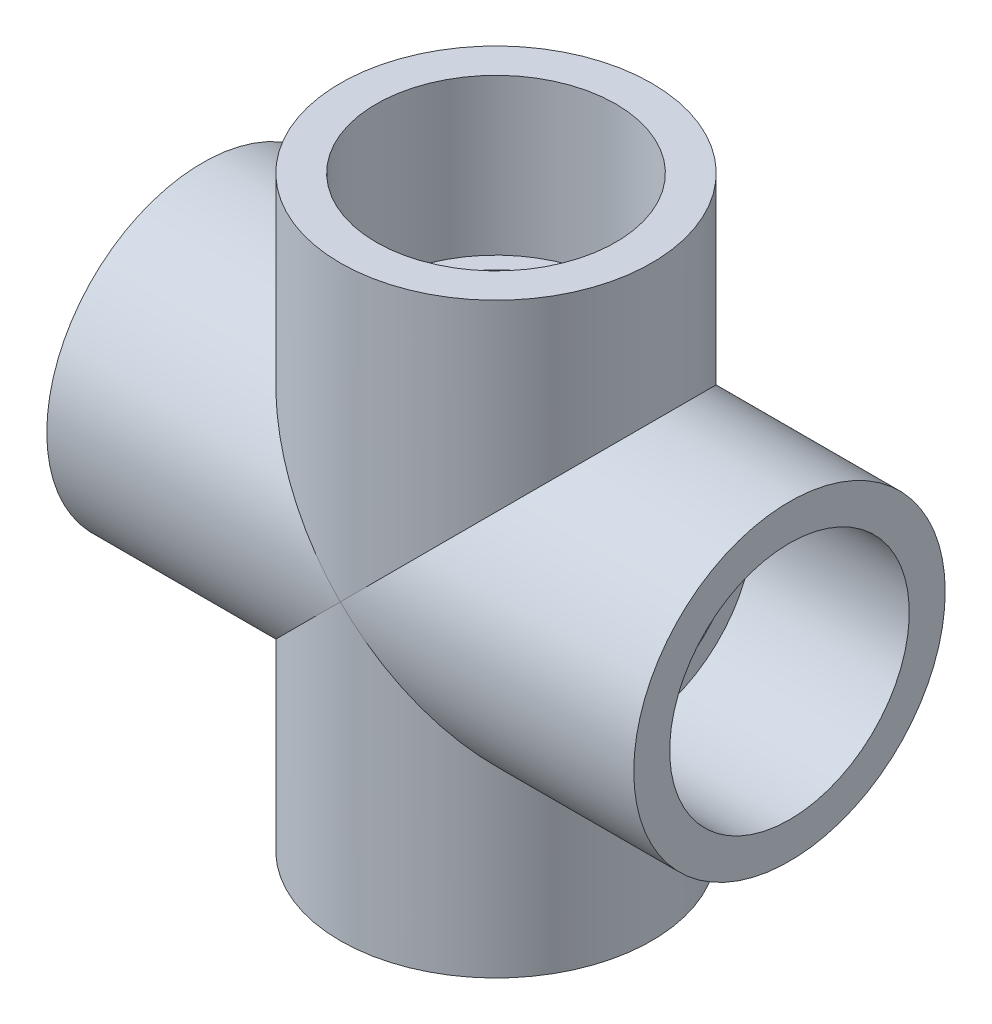
from build123d import *

# Parameters (mm, degrees)
SKETCH1_R           = 26
BOSS_EXTRUDE1_DEPTH = 49
CIRPATTERN1_COUNT   = 2
CIRPATTERN1_ANGLE   = 90
SKETCH2_R           = 20
CUT_EXTRUDE1_DEPTH  = 26
CIRPATTERN2_COUNT   = 4
SKETCH3_R           = 17
CUT_EXTRUDE2_DEPTH  = 91.890043459
CIRPATTERN3_COUNT   = 2
CIRPATTERN3_ANGLE   = 90
SCALE1_SCALE        = 0.2
SCALE2_SCALE        = 0.25


with BuildPart() as part:
    # Sketch1 → Boss-Extrude1 (new, symmetric)
    with BuildSketch(Plane(origin=(0, 0, 0), x_dir=(1, 0, 0), z_dir=(0, 1, 0))):
        Circle(SKETCH1_R)
    boss_extrude1 = extrude(amount=BOSS_EXTRUDE1_DEPTH, both=True)

    # CirPattern1: Boss-Extrude1 ×2 about axis
    cirpattern1_axis = Axis((0, 0, 50), (0, 0, -1))
    for i in range(1, CIRPATTERN1_COUNT):
        add(boss_extrude1.rotate(cirpattern1_axis, i * CIRPATTERN1_ANGLE / (CIRPATTERN1_COUNT - 1)))

    # Sketch2 → Cut-Extrude1 (cut)
    with BuildSketch(Plane(origin=(0, 49, 0), x_dir=(1, 0, 0), z_dir=(0, 1, 0))):
        Circle(SKETCH2_R)
    cut_extrude1 = extrude(amount=-CUT_EXTRUDE1_DEPTH, mode=Mode.SUBTRACT)

    # CirPattern2: Cut-Extrude1 ×4 about axis
    cirpattern2_axis = Axis((0, 0, 50), (0, 0, -1))
    for i in range(1, CIRPATTERN2_COUNT):
        add(cut_extrude1.rotate(cirpattern2_axis, i * 360 / CIRPATTERN2_COUNT), mode=Mode.SUBTRACT)

    # Sketch3 → Cut-Extrude2 (cut, through all)
    with BuildSketch(Plane(origin=(0, 23, 0), x_dir=(1, 0, 0), z_dir=(0, 1, 0))):
        Circle(SKETCH3_R)
    cut_extrude2 = extrude(amount=-CUT_EXTRUDE2_DEPTH, mode=Mode.SUBTRACT)

    # CirPattern3: Cut-Extrude2 ×2 about axis
    cirpattern3_axis = Axis((0, 0, 50), (0, 0, -1))
    for i in range(1, CIRPATTERN3_COUNT):
        add(cut_extrude2.rotate(cirpattern3_axis, i * CIRPATTERN3_ANGLE / (CIRPATTERN3_COUNT - 1)), mode=Mode.SUBTRACT)


with BuildPart() as part_1:
    # Scale1: scaled about (0, 0, 0)
    add(part.part.scale(SCALE1_SCALE))


with BuildPart() as part_2:
    # Scale2: scaled about (0, 0, 0)
    add(part_1.part.scale(SCALE2_SCALE))


solid = part_2.part
